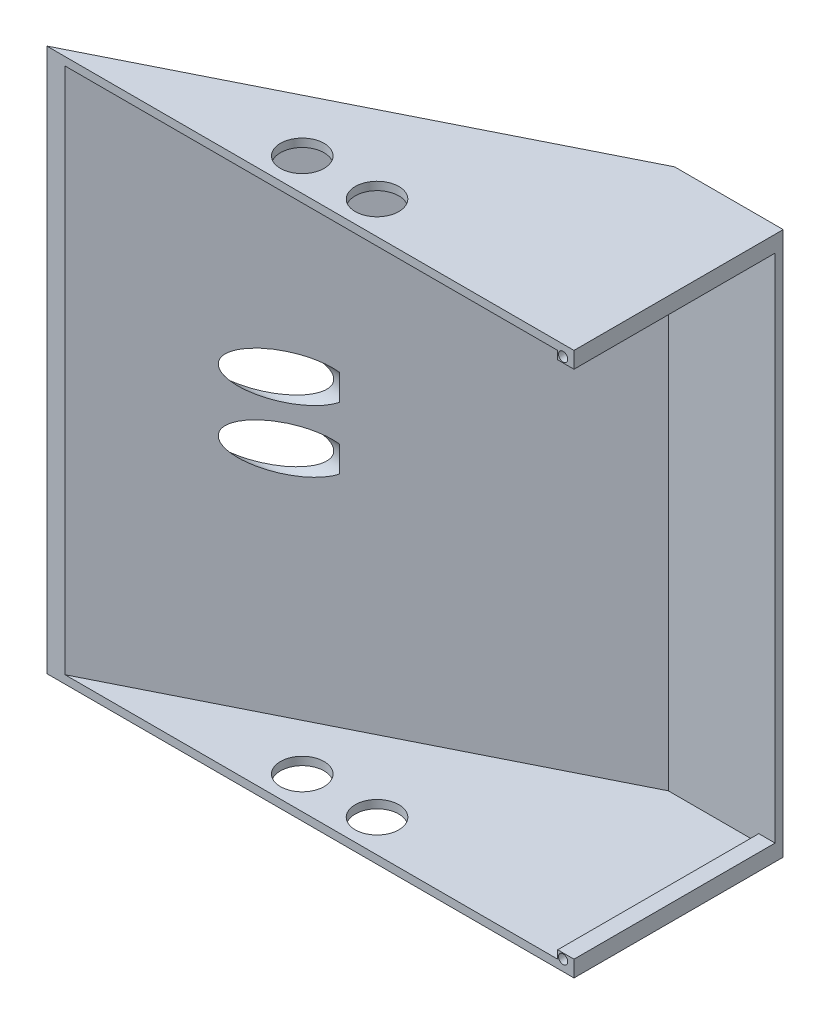
from build123d import *

# Parameters (mm, degrees)
SALIENTE_EXTRUIR2_DEPTH = 200
VACIADO2_T              = -3
CROQUIS6_R              = 8.2
CORTAR_EXTRUIR4_DEPTH   = 80
CROQUIS2_R              = 8.02
CORTAR_EXTRUIR5_DEPTH   = 3
CORTAR_EXTRUIR6_START   = -3
CROQUIS5_R              = 8.02
CORTAR_EXTRUIR6_DEPTH   = 3
CROQUIS7_W              = 7.4
CROQUIS7_H              = 7.4
CORTAR_EXTRUIR11_DEPTH  = 3
CROQUIS8_W              = 7.04
CROQUIS8_H              = 7.04
CORTAR_EXTRUIR12_DEPTH  = 3
CROQUIS9_W              = 35
CROQUIS9_H              = 35
CORTAR_EXTRUIR13_DEPTH  = 3
CROQUIS15_W             = 6
CROQUIS15_H             = 3
SALIENTE_EXTRUIR3_DEPTH = 75


with BuildPart() as part:
    # Croquis1 → Saliente-Extruir2 (new body)
    with BuildSketch(Plane(origin=(0, 0, 0), x_dir=(1, 0, 0), z_dir=(0, 1, 0))):
        Polygon((0, 0), (200, 0), (200, 80), (160, 80), align=None)
    extrude(amount=SALIENTE_EXTRUIR2_DEPTH)

    # Vaciado2
    vaciado2_openings = [part.faces().sort_by_distance(p)[0] for p in [
        (200, 100, -40),
    ]]
    offset(amount=VACIADO2_T, openings=vaciado2_openings, kind=Kind.INTERSECTION)

    # Croquis6 → Cortar-Extruir4 (cut)
    with BuildSketch(Plane(origin=(0, 0, 0), x_dir=(0, 0, -1), z_dir=(1, 0, 0))):
        with Locations(Location((30, 88.575, 0), (0, 0, 180))):
            Circle(CROQUIS6_R)
        with Locations(Location((30, 111.425, 0), (0, 0, 180))):
            Circle(CROQUIS6_R)
    extrude(amount=CORTAR_EXTRUIR4_DEPTH, mode=Mode.SUBTRACT)

    # Croquis2 → Cortar-Extruir5 (cut)
    with BuildSketch(Plane(origin=(0, 200, 0), x_dir=(1, 0, 0), z_dir=(0, 1, 0))):
        with Locations(Location((88.011571484, 15, 0), (0, 0, 270))):
            Circle(CROQUIS2_R)
        with Locations(Location((115.531571484, 15, 0), (0, 0, 270))):
            Circle(CROQUIS2_R)
    extrude(amount=-CORTAR_EXTRUIR5_DEPTH, mode=Mode.SUBTRACT)

    # Croquis5 → Cortar-Extruir6 (cut)
    with BuildSketch(Plane.XZ.offset(CORTAR_EXTRUIR6_START)):
        with Locations(Location((88.011571484, -15, 0), (0, 0, 90))):
            Circle(CROQUIS5_R)
        with Locations(Location((115.531571484, -15, 0), (0, 0, 90))):
            Circle(CROQUIS5_R)
    extrude(amount=CORTAR_EXTRUIR6_DEPTH, mode=Mode.SUBTRACT)

    # Croquis7 → Cortar-Extruir11 (cut)
    with BuildSketch(Plane.XY):
        with Locations((18.7, 13.7)):
            Rectangle(CROQUIS7_W, CROQUIS7_H)
    cortar_extruir11 = extrude(amount=-CORTAR_EXTRUIR11_DEPTH, mode=Mode.SUBTRACT)

    # Simetría5: Cortar-Extruir11 across plane
    add(cortar_extruir11.mirror(Plane.ZX.offset(100)), mode=Mode.SUBTRACT)

    # Croquis8 → Cortar-Extruir12 (cut)
    with BuildSketch(Plane.XY):
        with Locations((18.52, 100)):
            Rectangle(CROQUIS8_W, CROQUIS8_H)
    extrude(amount=-CORTAR_EXTRUIR12_DEPTH, mode=Mode.SUBTRACT)

    # Croquis9 → Cortar-Extruir13 (cut)
    with BuildSketch(Plane.XY):
        with Locations((174.5, 174.5)):
            Rectangle(CROQUIS9_W, CROQUIS9_H)
    cortar_extruir13 = extrude(amount=-CORTAR_EXTRUIR13_DEPTH, mode=Mode.SUBTRACT)

    # Simetría6: Cortar-Extruir13 across plane
    add(cortar_extruir13.mirror(Plane.ZX.offset(100)), mode=Mode.SUBTRACT)

    # Croquis15 → Saliente-Extruir3 (add)
    with BuildSketch(Plane(origin=(0, 0, -3), x_dir=(-1, 0, 0), z_dir=(0, 0, -1))):
        with Locations((-197, 4.5)):
            Rectangle(CROQUIS15_W, CROQUIS15_H)
    saliente_extruir3 = extrude(amount=SALIENTE_EXTRUIR3_DEPTH)

    # Simetría7: Saliente-Extruir3 across plane
    add(saliente_extruir3.mirror(Plane.ZX.offset(100)))

    # Croquis18 → Refrentado para tornillo tapón con cabeza plana de clavija de M33 (revolve, cut)
    with BuildSketch(Plane(origin=(196, 4, 0), x_dir=(0, -1, 0), z_dir=(1, 0, 0))):
        Polygon((0, 0), (0, 11.021463052), (1.7, 10), (1.7, 1.66), (3.36, 0), align=None)
    refrentado_para_tornillo_tap_n_con_cabez = revolve(axis=Axis((196, 4, 6.35), (0, 0, -1)), mode=Mode.SUBTRACT)

    # Simetría8: Refrentado para tornillo tapón con cabeza plana de clavija de M33 across plane
    add(refrentado_para_tornillo_tap_n_con_cabez.mirror(Plane.ZX.offset(100)), mode=Mode.SUBTRACT)

    # Simetría9: Refrentado para tornillo tapón con cabeza plana de clavija de M33 across plane
    add(refrentado_para_tornillo_tap_n_con_cabez.mirror(Plane(origin=(100, 0, 0), x_dir=(0, 0, 1), z_dir=(1, 0, 0))), mode=Mode.SUBTRACT)

    # Simetría9 copy 1 sketch → Simetría9 copy 1 (revolve, cut)
    with BuildSketch(Plane(origin=(4, 196, 0), x_dir=(0, 1, 0), z_dir=(-1, 0, 0))):
        Polygon((0, 0), (0, 11.021463052), (1.7, 10), (1.7, 1.66), (3.36, 0), align=None)
    revolve(axis=Axis((4, 196, 6.35), (0, 0, -1)), mode=Mode.SUBTRACT)

    # Partir1
    split(bisect_by=Plane.XY.offset(-3), keep=Keep.BOTTOM)


solid = part.part
